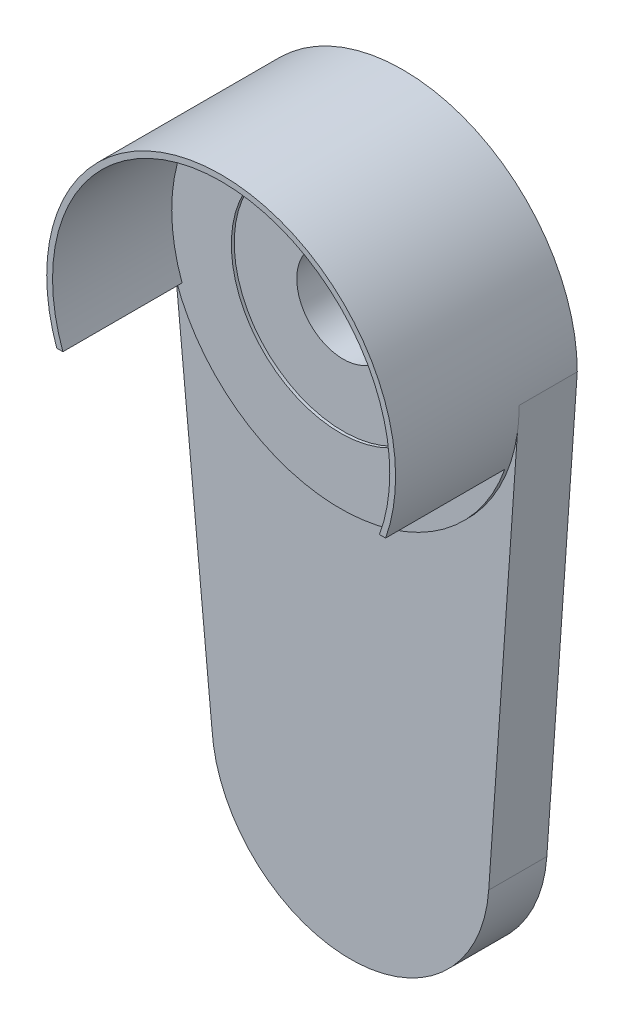
from build123d import *
from build123d.topology import SkipClean

# Parameters (mm, degrees)
SKETCH2_R               = 120
BOSS_EXTRUDE2_DEPTH     = 85
CUT_EXTRUDE1_START      = -82
CUT_EXTRUDE1_DEPTH      = 82
CUT_EXTRUDE5_DEPTH      = 2
CUT_EXTRUDE5_DEPTH_BACK = 2
SKETCH8_R               = 75
SKETCH9_R               = 32
CUT_EXTRUDE6_DEPTH      = 5
BOSS_EXTRUDE4_START     = 40
SKETCH12_R              = 32
BOSS_EXTRUDE4_DEPTH     = 40


with BuildPart() as part:
    # Sketch2 → Boss-Extrude2 (new body)
    with BuildSketch(Plane.XY):
        Circle(SKETCH2_R)
    extrude(amount=BOSS_EXTRUDE2_DEPTH)

    # Sketch3 → Cut-Extrude1 (cut)
    with BuildSketch(Plane.XY.offset(85).offset(CUT_EXTRUDE1_START)):
        with BuildLine():
            Line((-108.885260711, -40), (-113.13708499, -40))
            ThreePointArc((-113.13708499, -40), (0, -120), (113.13708499, -40))
            Line((113.13708499, -40), (108.885260711, -40))
            ThreePointArc((108.885260711, -40), (0, 116), (-108.885260711, -40))
        make_face()
    extrude(amount=CUT_EXTRUDE1_DEPTH, mode=Mode.SUBTRACT)

    # Sketch8 → Cut-Extrude5 (cut, two sides: drawn at the far end of the back side and taken through both)
    with BuildSketch(Plane.XY.offset(3).offset(-CUT_EXTRUDE5_DEPTH_BACK)):
        Circle(SKETCH8_R)
    extrude(amount=CUT_EXTRUDE5_DEPTH + CUT_EXTRUDE5_DEPTH_BACK, mode=Mode.SUBTRACT)

    # Sketch9 → Cut-Extrude6 (cut)
    with BuildSketch(Plane.XY.offset(1)):
        Circle(SKETCH9_R)
    extrude(amount=-CUT_EXTRUDE6_DEPTH, mode=Mode.SUBTRACT)

    # Sketch12 → Boss-Extrude4 (add)
    # profile 1 of 2: a face of its own
    with SkipClean():  # the faces are left unmerged after this step: merging them gives an invalid solid
        with BuildSketch(Plane(origin=(0, 0, 0), x_dir=(-1, 0, 0), z_dir=(0, 0, -1)).offset(BOSS_EXTRUDE4_START)):
            with BuildLine():
                ThreePointArc((120, 0), (0, 120), (-120, 0))
                Line((-120, 0), (-118.831087629, -16.70845932))
                ThreePointArc((-118.831087629, -16.70845932), (-3.111785776, -119.959646504), (117.805011812, -22.84686394))
                Line((117.805011812, -22.84686394), (120, 0))
            make_face()
            with Locations(Location((0, 0, 0), (0, 0, 180))):
                Circle(SKETCH12_R, mode=Mode.SUBTRACT)
        # profile 2 of 2: a face of its own
        with BuildSketch(Plane(origin=(0, 0, 0), x_dir=(-1, 0, 0), z_dir=(0, 0, -1)).offset(BOSS_EXTRUDE4_START)):
            with BuildLine():
                ThreePointArc((117.805011812, -22.84686394), (-3.111785776, -119.959646504), (-118.831087629, -16.70845932))
                Line((-118.831087629, -16.70845932), (-99.063378042, -299.268538041))
                ThreePointArc((-99.063378042, -299.268538041), (-3.575656086, -388.008129656), (91.309922092, -298.624981255))
                Line((91.309922092, -298.624981255), (117.805011812, -22.84686394))
            make_face()
        extrude(amount=-BOSS_EXTRUDE4_DEPTH)


solid = part.part
